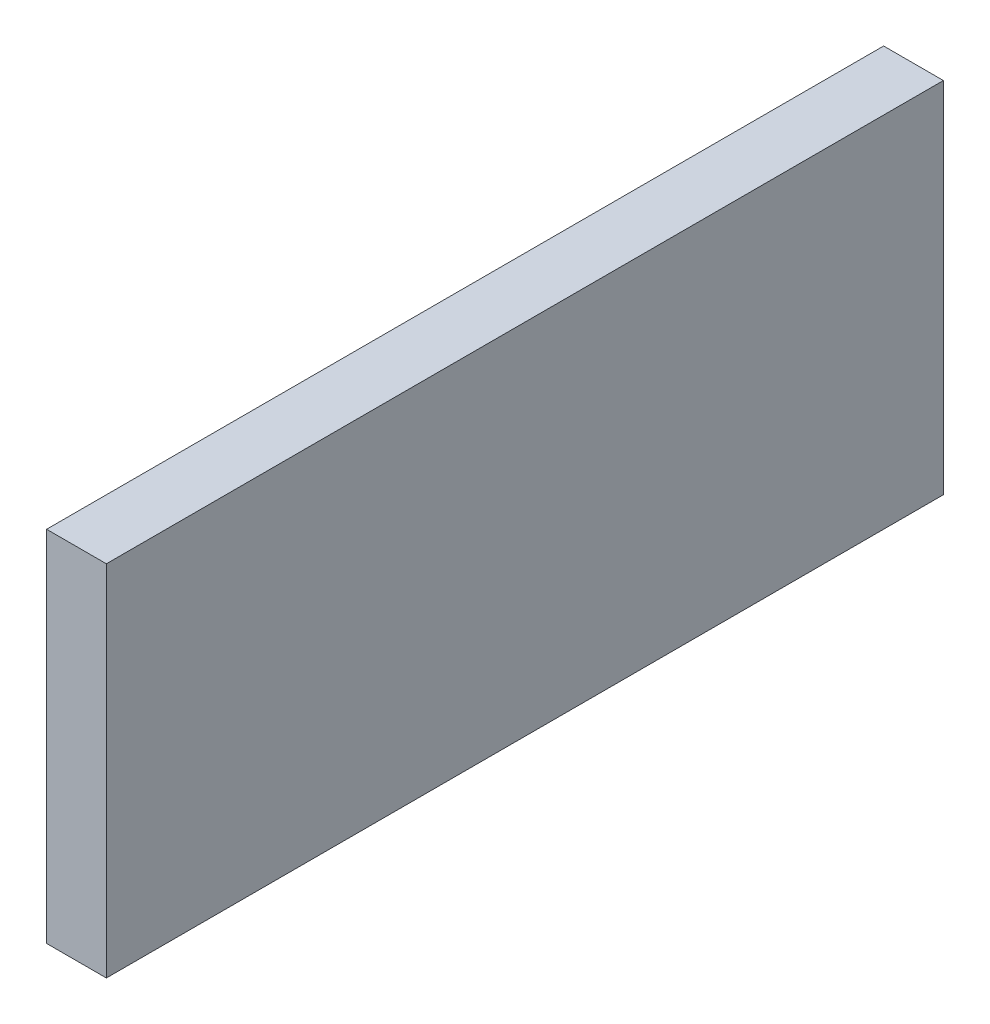
from build123d import *

# Parameters (mm, degrees)
SKETCH1_W           = 35
SKETCH1_H           = 15
BOSS_EXTRUDE1_DEPTH = 2.5


with BuildPart() as part:
    # Sketch1 → Boss-Extrude1 (new body)
    with BuildSketch(Plane(origin=(0, 6.812867368, -4.849837787), x_dir=(0, 0, -1), z_dir=(1, 0, 0))):
        with Locations((1.885855655, 8.527679414)):
            Rectangle(SKETCH1_W, SKETCH1_H)
    extrude(amount=BOSS_EXTRUDE1_DEPTH)


solid = part.part
